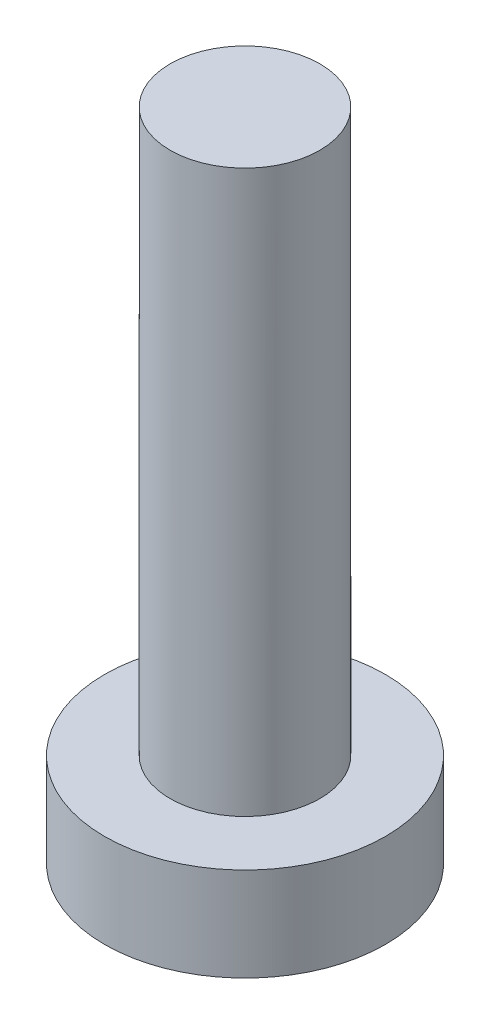
from build123d import *

# Parameters (mm, degrees)
SKETCH2_R           = 0.8
BOSS_EXTRUDE1_DEPTH = 6
SKETCH3_R           = 1.5
BOSS_EXTRUDE2_DEPTH = 1


with BuildPart() as part:
    # Sketch2 → Boss-Extrude1 (new body)
    with BuildSketch(Plane(origin=(0, 0, 0), x_dir=(1, 0, 0), z_dir=(0, 1, 0))):
        with Locations(Location((0, 0, 0), (0, 0, 270))):
            Circle(SKETCH2_R)
    extrude(amount=BOSS_EXTRUDE1_DEPTH)

    # Sketch3 → Boss-Extrude2 (add)
    with BuildSketch(Plane.XZ):
        with Locations(Location((0, 0, 0), (0, 0, 270))):
            Circle(SKETCH3_R)
    extrude(amount=BOSS_EXTRUDE2_DEPTH)


solid = part.part
